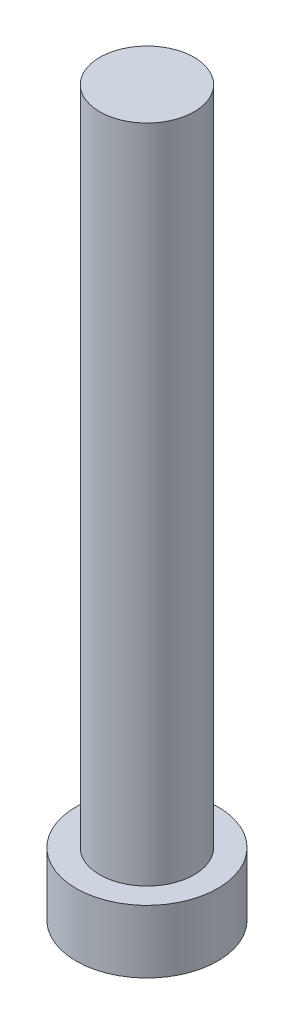
from build123d import *

# Parameters (mm, degrees)
SKETCH1_R           = 22.5
BOSS_EXTRUDE1_DEPTH = 20
SKETCH2_R           = 15
BOSS_EXTRUDE2_DEPTH = 210


with BuildPart() as part:
    # Sketch1 → Boss-Extrude1 (new body)
    with BuildSketch(Plane(origin=(0, 0, 0), x_dir=(1, 0, 0), z_dir=(0, 1, 0))):
        with Locations(Location((0, 0, 0), (0, 0, 270))):
            Circle(SKETCH1_R)
    extrude(amount=BOSS_EXTRUDE1_DEPTH)

    # Sketch2 → Boss-Extrude2 (add)
    with BuildSketch(Plane(origin=(0, 20, 0), x_dir=(1, 0, 0), z_dir=(0, 1, 0))):
        with Locations(Location((0, 0, 0), (0, 0, 270))):
            Circle(SKETCH2_R)
    extrude(amount=BOSS_EXTRUDE2_DEPTH)


solid = part.part
